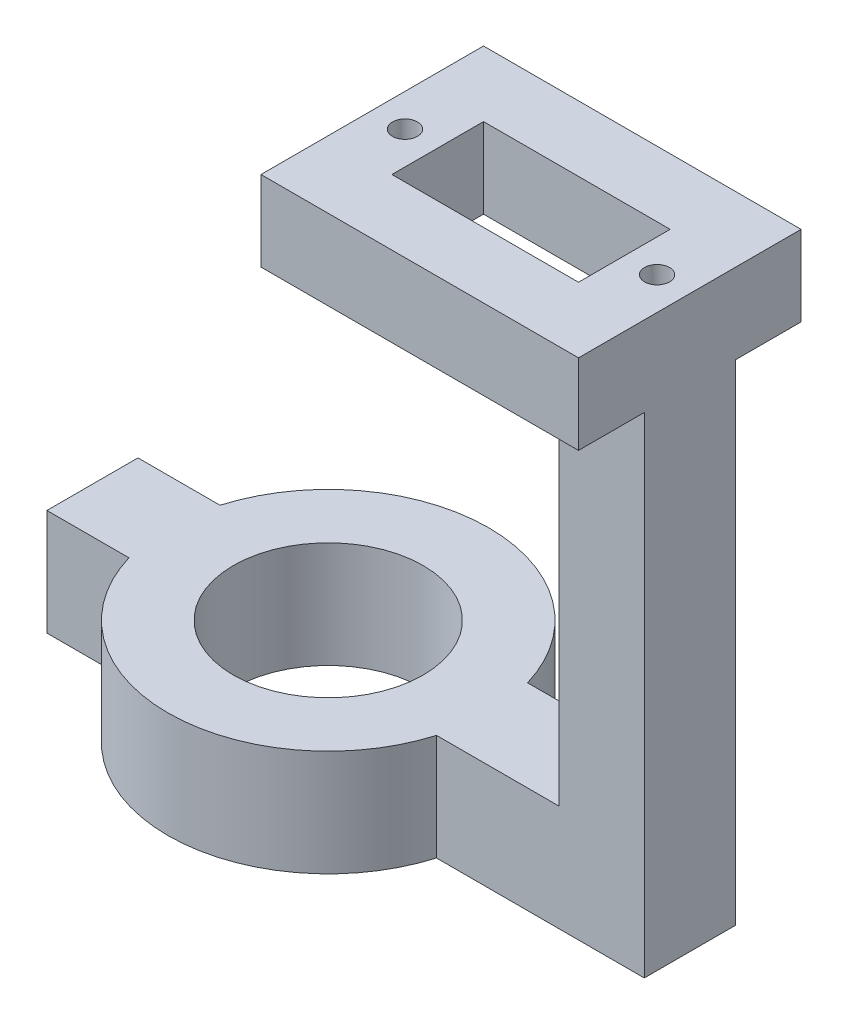
from build123d import *

# Parameters (mm, degrees)
SKETCH_1_W           = 48.51
SKETCH_1_H           = 34
SKETCH_1_W_2         = 28.51
SKETCH_1_H_2         = 14
EXTRUDE_1_DEPTH      = 12.25
SKETCH_2_R           = 1.91
CUT_EXTRUDE_1_DEPTH  = 33.05257439
SKETCH_4_W           = 13
SKETCH_4_H           = 13.91
EXTRUDE_1_2_DEPTH    = 74.82
SKETCH_5_W           = 13.91
SKETCH_5_H           = 16.23
EXTRUDE_2_DEPTH      = 23.57
SKETCH_7_R           = 24.5
SKETCH_7_R_2         = 14.5
EXTRUDE_2_2_DEPTH    = 16.23
EXTRUDE_3_DEPTH      = 13.15
EXTRUDE_3_DEPTH_BACK = 7
SKETCH_9_W           = 13.91
SKETCH_9_H           = 16.23


with BuildPart() as part:
    # 草圖1 → Extrude 1 (new body)
    with BuildSketch(Plane(origin=(0, 0, 0), x_dir=(1, 0, 0), z_dir=(0, 1, 0))):
        Rectangle(SKETCH_1_W, SKETCH_1_H)
        Rectangle(SKETCH_1_W_2, SKETCH_1_H_2, mode=Mode.SUBTRACT)
    extrude(amount=EXTRUDE_1_DEPTH)

    # 草圖2 → 除料-伸長1 (cut, through all)
    with BuildSketch(Plane(origin=(0, 12.25, 0), x_dir=(1, 0, 0), z_dir=(0, 1, 0))):
        with Locations(Location((-19.255, 0, 0), (0, 0, 270))):
            Circle(SKETCH_2_R)
        with Locations(Location((19.255, 0, 0), (0, 0, 270))):
            Circle(SKETCH_2_R)
    extrude(amount=-CUT_EXTRUDE_1_DEPTH, mode=Mode.SUBTRACT)

    # 草圖4 → Extrude 1 2 (add)
    with BuildSketch(Plane.XZ):
        with Locations((17.755, 0)):
            Rectangle(SKETCH_4_W, SKETCH_4_H)
    extrude(amount=EXTRUDE_1_2_DEPTH)

    # 草圖5 → Extrude 2 (add)
    with BuildSketch(Plane.ZY.offset(-11.255)):
        with Locations((0, -66.705)):
            Rectangle(SKETCH_5_W, SKETCH_5_H)
    extrude(amount=EXTRUDE_2_DEPTH)

    # 草圖7 → Extrude 2 2 (add)
    with BuildSketch(Plane.XZ.offset(74.82)):
        with Locations((-30.978154344, 0)):
            Circle(SKETCH_7_R)
        with Locations((-30.978154344, 0)):
            Circle(SKETCH_7_R_2, mode=Mode.SUBTRACT)
    extrude(amount=-EXTRUDE_2_2_DEPTH)

    # 草圖9 → 填料-伸長3 (add, two sides: drawn at the far end of the back side and taken through both)
    with BuildSketch(Plane(origin=(-60, 0, 0), x_dir=(0, 0, -1), z_dir=(1, 0, 0)).offset(-EXTRUDE_3_DEPTH_BACK)):
        with Locations((0, -66.705)):
            Rectangle(SKETCH_9_W, SKETCH_9_H)
    extrude(amount=EXTRUDE_3_DEPTH + EXTRUDE_3_DEPTH_BACK)


solid = part.part
